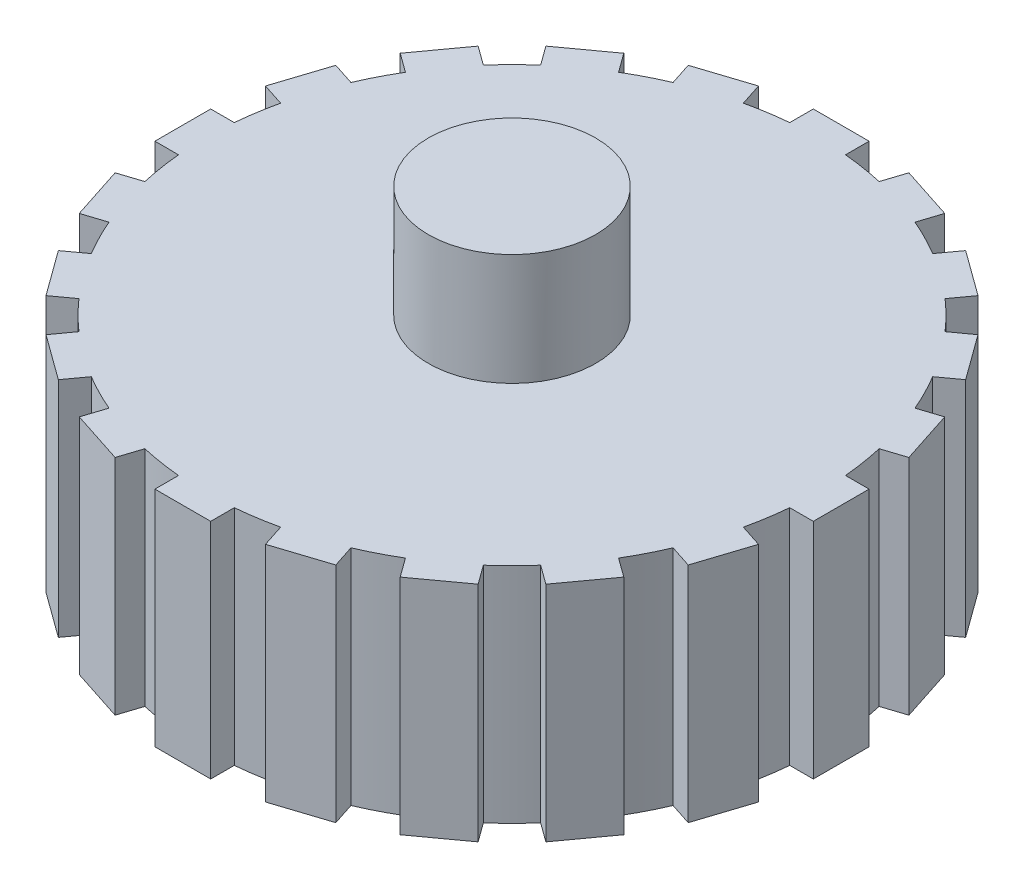
from build123d import *

# Parameters (mm, degrees)
ESQUISSE1_R                  = 7.5
BOSS_EXTRU_1_DEPTH           = 40
ESQUISSE2_R                  = 27.5
BOSS_EXTRU_2_DEPTH           = 20
ESQUISSE3_W                  = 5
ESQUISSE3_H                  = 20
BOSS_EXTRU_3_DEPTH           = 7
R_P_TITION_CIRCULAIRE1_COUNT = 20


with BuildPart() as part:
    # Esquisse1 → Boss.-Extru.1 (new body)
    with BuildSketch(Plane(origin=(0, 0, 0), x_dir=(1, 0, 0), z_dir=(0, 1, 0))):
        with Locations(Location((0, 0, 0), (0, 0, 270))):
            Circle(ESQUISSE1_R)
    extrude(amount=BOSS_EXTRU_1_DEPTH)

    # Esquisse2 → Boss.-Extru.2 (add)
    with BuildSketch(Plane(origin=(0, 10, 0), x_dir=(-1, 0, 0), z_dir=(0, -1, 0))):
        with Locations(Location((0, 0, 0), (0, 0, 90))):
            Circle(ESQUISSE2_R)
    extrude(amount=-BOSS_EXTRU_2_DEPTH)

    # Esquisse3 → Boss.-Extru.3 (add)
    with BuildSketch(Plane.XY.offset(22.5)):
        with Locations((0, 20)):
            Rectangle(ESQUISSE3_W, ESQUISSE3_H)
    boss_extru_3 = extrude(amount=BOSS_EXTRU_3_DEPTH)

    # Répétition circulaire1: Boss.-Extru.3 ×20 about axis
    r_p_tition_circulaire1_axis = Axis((0, 0, 0), (0, 1, 0))
    for i in range(1, R_P_TITION_CIRCULAIRE1_COUNT):
        add(boss_extru_3.rotate(r_p_tition_circulaire1_axis, i * 360 / R_P_TITION_CIRCULAIRE1_COUNT))


solid = part.part
